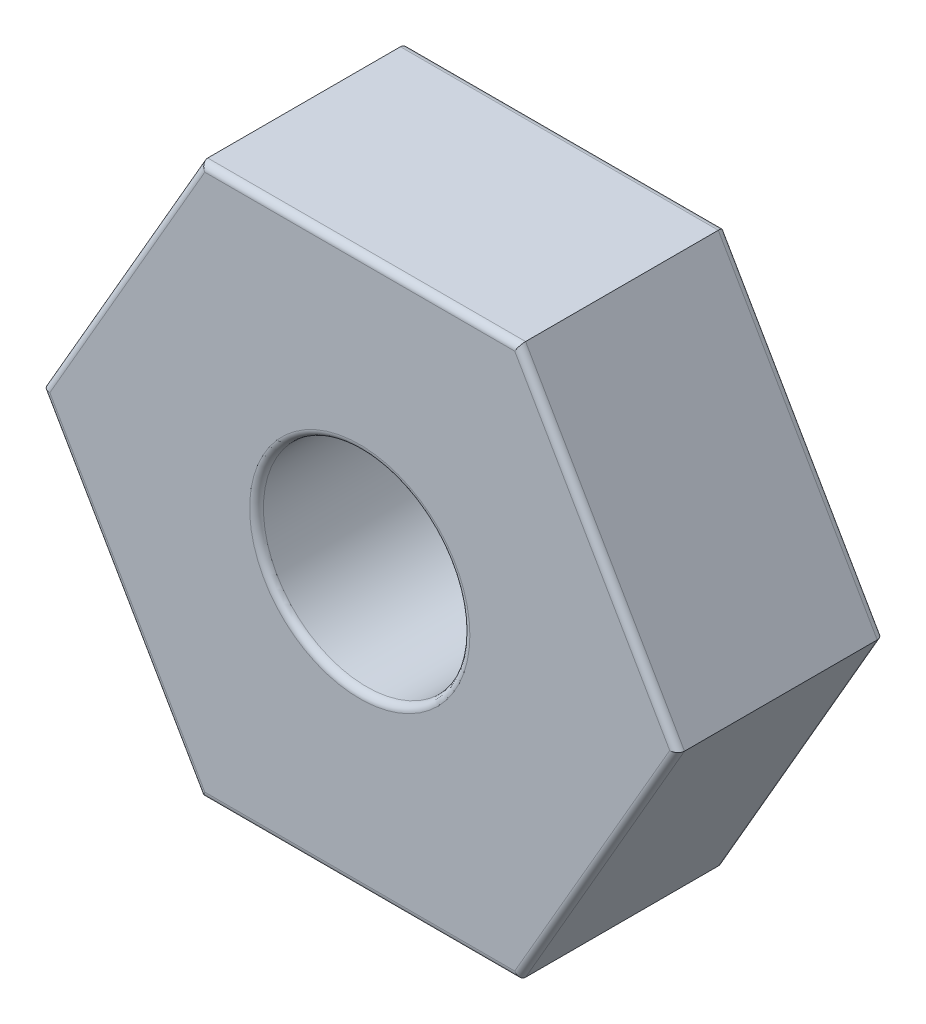
from build123d import *

# Parameters (mm, degrees)
SKIZZE1_R                       = 1.5
AUFSATZ_LINEAR_AUSTRAGEN1_DEPTH = 3
VERRUNDUNG1_R                   = 0.1


with BuildPart() as part:
    # Skizze1 → Aufsatz-Linear austragen1 (new body)
    with BuildSketch(Plane.XY):
        Polygon((-2.309401077, 4), (-4.618802154, 0), (-2.309401077, -4), (2.309401077, -4), (4.618802154, 0), (2.309401077, 4), align=None)
        Circle(SKIZZE1_R, mode=Mode.SUBTRACT)
    extrude(amount=AUFSATZ_LINEAR_AUSTRAGEN1_DEPTH)

    # Verrundung1
    verrundung1_edges = [part.edges().sort_by_distance(p)[0] for p in [
        (-3.464101615, -2, 3),
        (0, -4, 3),
        (3.464101615, -2, 3),
        (-1.5, 0, 0),
        (-1.5, 0, 3),
        (3.464101615, 2, 3),
        (0, 4, 3),
        (3.464101615, 2, 0),
        (3.464101615, -2, 0),
        (0, -4, 0),
        (-3.464101615, 2, 3),
        (-3.464101615, -2, 0),
        (-3.464101615, 2, 0),
        (0, 4, 0),
    ]]
    fillet(verrundung1_edges, radius=VERRUNDUNG1_R)


solid = part.part
